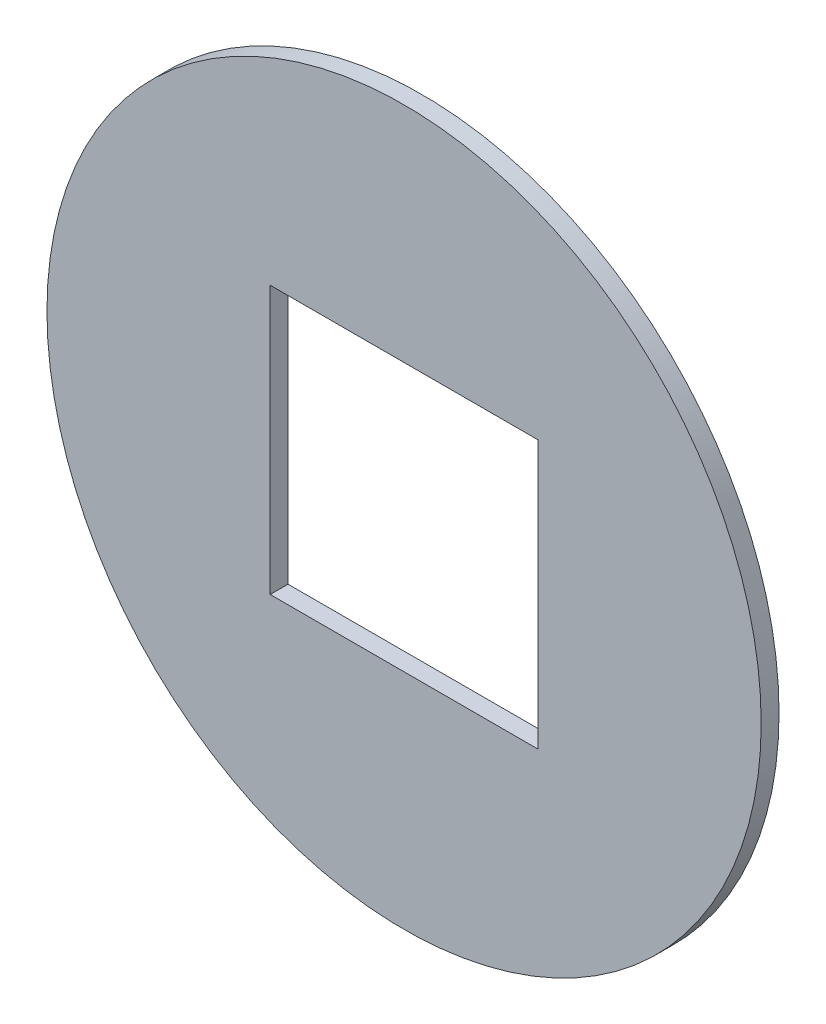
from build123d import *

# Parameters (mm, degrees)
SKETCH1_R           = 10
BOSS_EXTRUDE1_DEPTH = 0.5
SKETCH2_W           = 7.5
SKETCH2_H           = 7.5
BOSS_EXTRUDE2_DEPTH = 0.5
SKETCH3_W           = 7.5
SKETCH3_H           = 7.5
CUT_EXTRUDE1_DEPTH  = 15.150971698


with BuildPart() as part:
    # Sketch1 → Boss-Extrude1 (new body)
    with BuildSketch(Plane.XY):
        Circle(SKETCH1_R)
    extrude(amount=BOSS_EXTRUDE1_DEPTH)

    # Sketch2 → Boss-Extrude2 (add, through all)
    with BuildSketch(Plane.XY.offset(0.5)):
        Rectangle(SKETCH2_W, SKETCH2_H)
    extrude(amount=-BOSS_EXTRUDE2_DEPTH)

    # Sketch3 → Cut-Extrude1 (cut, through all)
    with BuildSketch(Plane.XY.offset(0.5)):
        Rectangle(SKETCH3_W, SKETCH3_H)
    extrude(amount=-CUT_EXTRUDE1_DEPTH, mode=Mode.SUBTRACT)


solid = part.part
